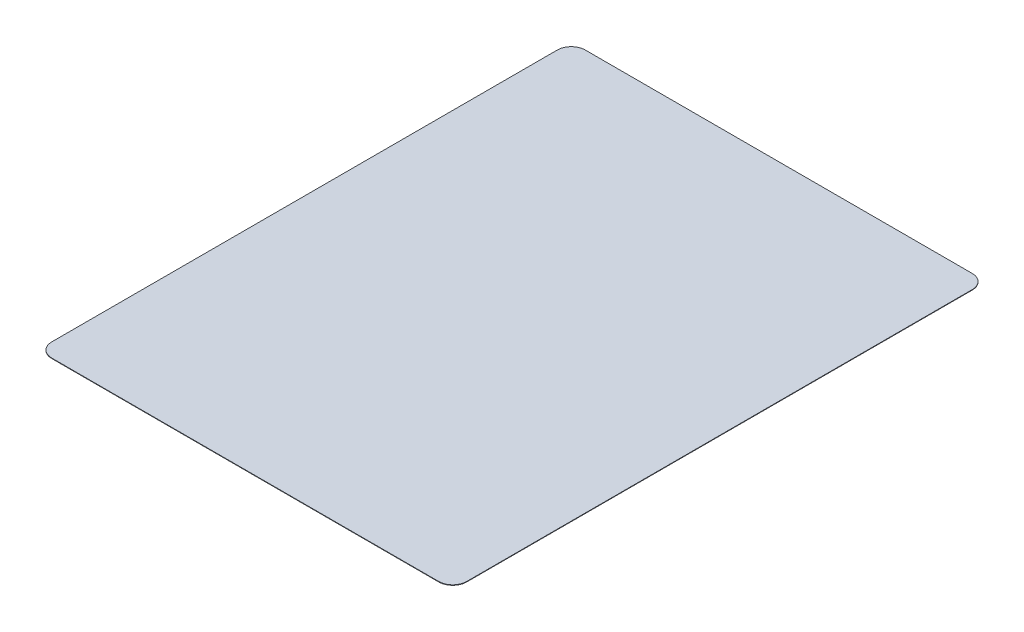
from build123d import *

# Parameters (mm, degrees)
SKETCH1_W           = 88.9
SKETCH1_H           = 114.3
BOSS_EXTRUDE1_DEPTH = 0.1
FILLET1_R           = 3


with BuildPart() as part:
    # Sketch1 → Boss-Extrude1 (new body)
    with BuildSketch(Plane(origin=(0, 0, 0), x_dir=(1, 0, 0), z_dir=(0, 1, 0))):
        Rectangle(SKETCH1_W, SKETCH1_H)
    extrude(amount=BOSS_EXTRUDE1_DEPTH)

    # Fillet1
    fillet1_edges = [part.edges().sort_by_distance(p)[0] for p in [
        (-44.45, 0.05, -57.15),
        (44.45, 0.05, -57.15),
        (44.45, 0.05, 57.15),
        (-44.45, 0.05, 57.15),
    ]]
    fillet(fillet1_edges, radius=FILLET1_R)


solid = part.part
